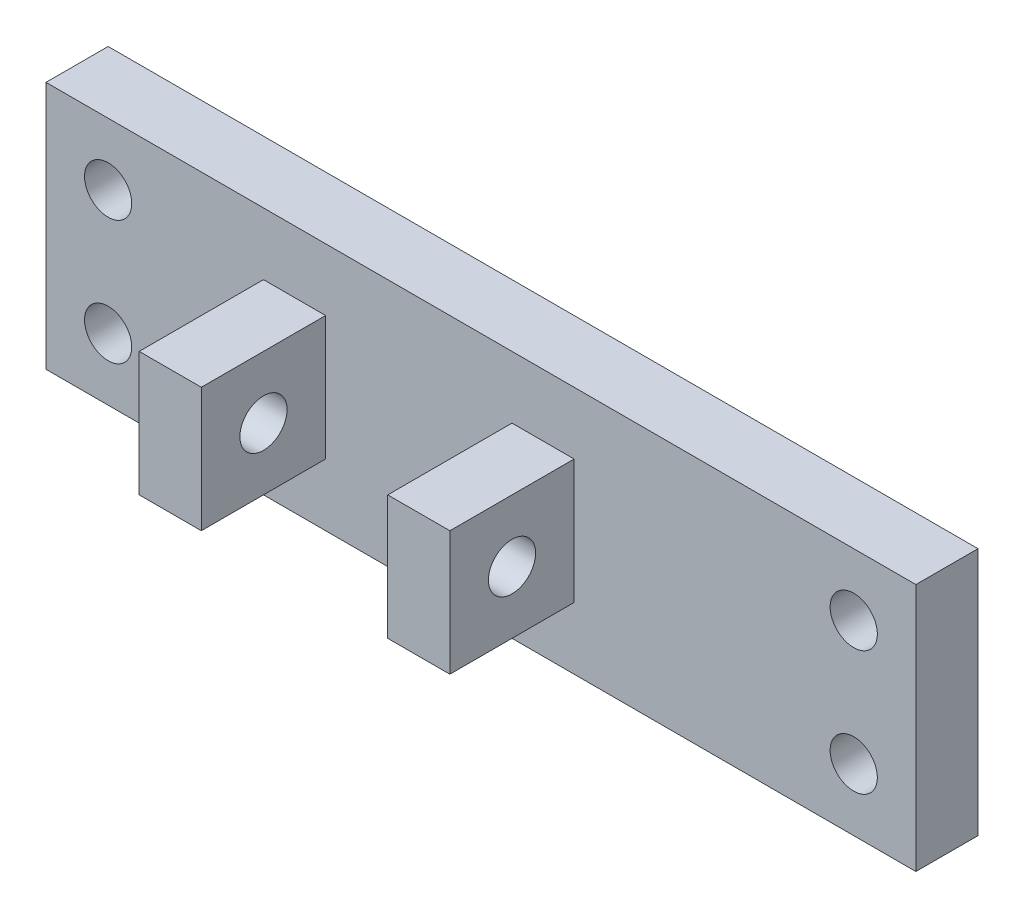
from build123d import *

# Parameters (mm, degrees)
SKETCH_1_W          = 70
SKETCH_1_H          = 20
EXTRUDE_1_DEPTH     = 5
SKETCH_2_R          = 1.9
CUT_EXTRUDE_1_DEPTH = 5
SKETCH_3_W          = 25
SKETCH_3_H          = 10
EXTRUDE_2_DEPTH     = 10
SKETCH_4_W          = 15
SKETCH_4_H          = 10
CUT_EXTRUDE_2_DEPTH = 10
SKETCH_5_R          = 1.9
CUT_EXTRUDE_3_DEPTH = 56.509008278


with BuildPart() as part:
    # ｽｹｯﾁ1 → ﾎﾞｽ - 押し出し1 (new body)
    with BuildSketch(Plane.XY):
        Rectangle(SKETCH_1_W, SKETCH_1_H)
    extrude(amount=EXTRUDE_1_DEPTH)

    # ｽｹｯﾁ2 → ｶｯﾄ - 押し出し1 (cut)
    with BuildSketch(Plane.XY.offset(5)):
        with Locations((-30, 5)):
            Circle(SKETCH_2_R)
        with Locations((-30, -5)):
            Circle(SKETCH_2_R)
        with Locations((30, 5)):
            Circle(SKETCH_2_R)
        with Locations((30, -5)):
            Circle(SKETCH_2_R)
    extrude(amount=-CUT_EXTRUDE_1_DEPTH, mode=Mode.SUBTRACT)

    # ｽｹｯﾁ3 → ﾎﾞｽ - 押し出し2 (add)
    with BuildSketch(Plane.XY.offset(5)):
        with Locations((-5, 0)):
            Rectangle(SKETCH_3_W, SKETCH_3_H)
    extrude(amount=EXTRUDE_2_DEPTH)

    # ｽｹｯﾁ4 → ｶｯﾄ - 押し出し2 (cut)
    with BuildSketch(Plane.XY.offset(15)):
        with Locations((-5, 0)):
            Rectangle(SKETCH_4_W, SKETCH_4_H)
    extrude(amount=-CUT_EXTRUDE_2_DEPTH, mode=Mode.SUBTRACT)

    # ｽｹｯﾁ5 → ｶｯﾄ - 押し出し3 (cut, through all)
    with BuildSketch(Plane.ZY.offset(17.5)):
        with Locations((10, 0)):
            Circle(SKETCH_5_R)
    extrude(amount=-CUT_EXTRUDE_3_DEPTH, mode=Mode.SUBTRACT)


solid = part.part
